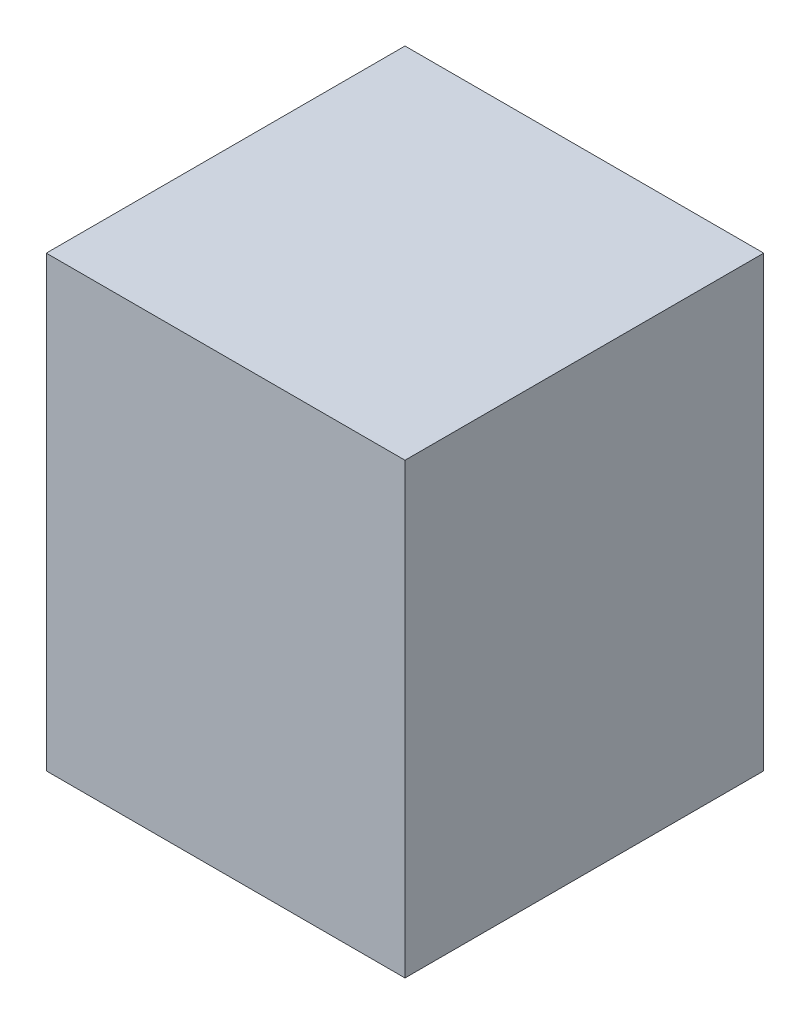
from build123d import *

# Parameters (mm, degrees)
SKETCH_1_W      = 4
SKETCH_1_H      = 5
EXTRUDE_1_DEPTH = 4


with BuildPart() as part:
    # Эскиз1 → Бобышка-Вытянуть1 (new body)
    with BuildSketch(Plane.XY):
        with Locations((2, 2.5)):
            Rectangle(SKETCH_1_W, SKETCH_1_H)
    extrude(amount=EXTRUDE_1_DEPTH)


solid = part.part
